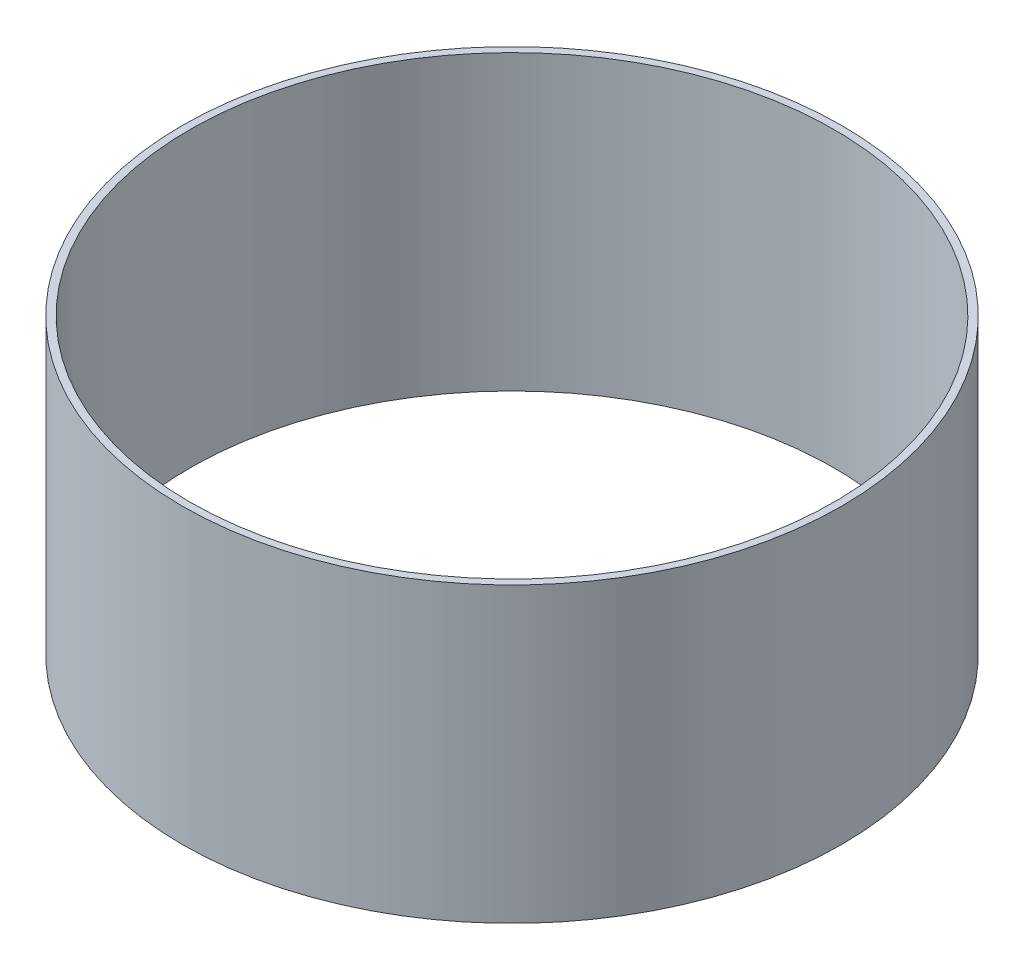
from build123d import *

# Parameters (mm, degrees)
SKETCH1_R           = 22.5
BOSS_EXTRUDE1_DEPTH = 20
SKETCH2_R           = 22
CUT_EXTRUDE1_DEPTH  = 20


with BuildPart() as part:
    # Sketch1 → Boss-Extrude1 (new body)
    with BuildSketch(Plane(origin=(0, 0, 0), x_dir=(1, 0, 0), z_dir=(0, 1, 0))):
        with Locations(Location((0, 0, 0), (0, 0, 270))):
            Circle(SKETCH1_R)
    extrude(amount=BOSS_EXTRUDE1_DEPTH)

    # Sketch2 → Cut-Extrude1 (cut)
    with BuildSketch(Plane(origin=(0, 20, 0), x_dir=(1, 0, 0), z_dir=(0, 1, 0))):
        with Locations(Location((0, 0, 0), (0, 0, 270))):
            Circle(SKETCH2_R)
    extrude(amount=-CUT_EXTRUDE1_DEPTH, mode=Mode.SUBTRACT)


solid = part.part
